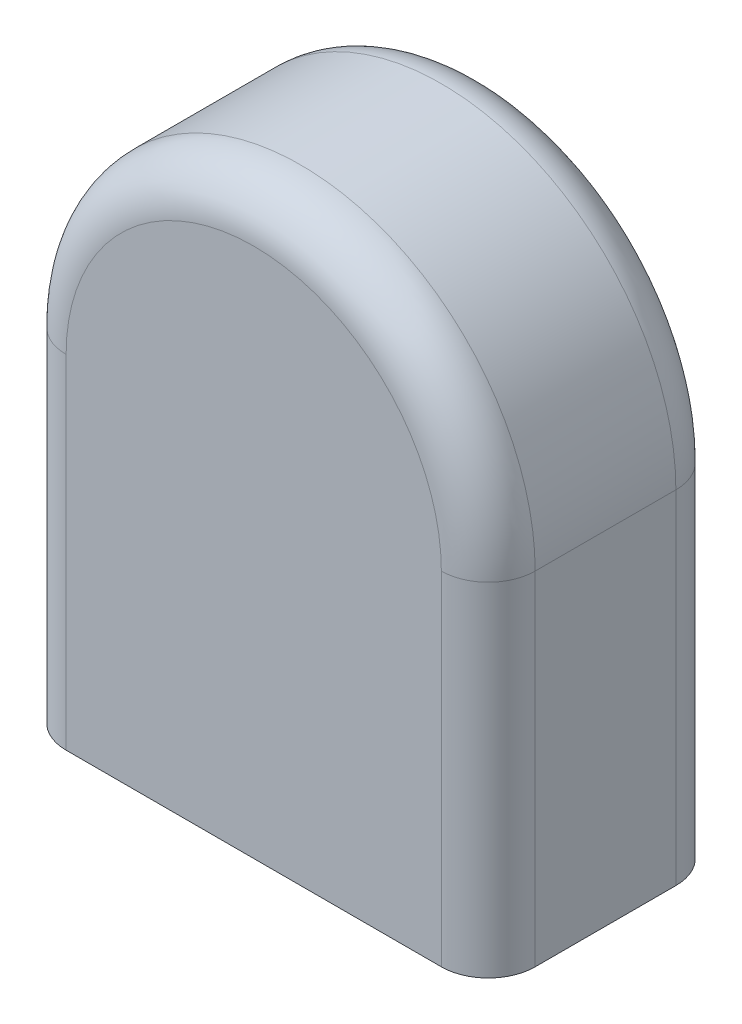
from build123d import *

# Parameters (mm, degrees)
BASE_EXTRUDE_DEPTH = 3.25
SKETCH2_R          = 3.25
CUT_EXTRUDE1_DEPTH = 3
FILLET1_R          = 1.3
FILLET2_R          = 0.6


with BuildPart() as part:
    # Sketch1 → Base-Extrude (new, symmetric)
    with BuildSketch(Plane.XY):
        with BuildLine():
            Line((-6.5, 0), (6.5, 0))
            Line((6.5, 0), (6.5, 9.5))
            ThreePointArc((6.5, 9.5), (0, 16), (-6.5, 9.5))
            Line((-6.5, 9.5), (-6.5, 0))
        make_face()
    extrude(amount=BASE_EXTRUDE_DEPTH, both=True)

    # Sketch2 → Cut-Extrude1 (cut)
    with BuildSketch(Plane(origin=(0, 0, -3.25), x_dir=(-1, 0, 0), z_dir=(0, 0, -1))):
        with Locations((0, 9.5)):
            Circle(SKETCH2_R)
    extrude(amount=-CUT_EXTRUDE1_DEPTH, mode=Mode.SUBTRACT)

    # Fillet1
    fillet1_edges = [part.edges().sort_by_distance(p)[0] for p in [
        (6.5, 4.75, 3.25),
        (0, 16, 3.25),
        (-6.5, 4.75, 3.25),
        (0, 16, -3.25),
        (6.5, 4.75, -3.25),
        (-6.5, 4.75, -3.25),
    ]]
    fillet(fillet1_edges, radius=FILLET1_R)

    # Fillet2
    fillet2_edges = [part.edges().sort_by_distance(p)[0] for p in [
        (3.25, 9.5, -0.25),
        (3.25, 9.5, -3.25),
    ]]
    fillet(fillet2_edges, radius=FILLET2_R)


solid = part.part
